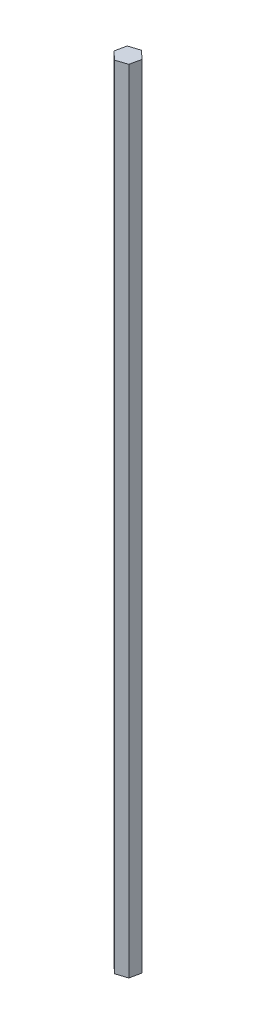
from build123d import *

# Parameters (mm, degrees)
BOSS_EXTRUDE1_DEPTH = 203.2


with BuildPart() as part:
    # Sketch2 → Boss-Extrude1 (new body)
    with BuildSketch(Plane(origin=(0, 0, 0), x_dir=(1, 0, 0), z_dir=(0, 1, 0))):
        Polygon((2.137295047, -1.940438924), (2.749116926, 0.880732344), (0.611821879, 2.821171268), (-2.137295047, 1.940438924), (-2.749116926, -0.880732344), (-0.611821879, -2.821171268), align=None)
    extrude(amount=BOSS_EXTRUDE1_DEPTH)


solid = part.part
